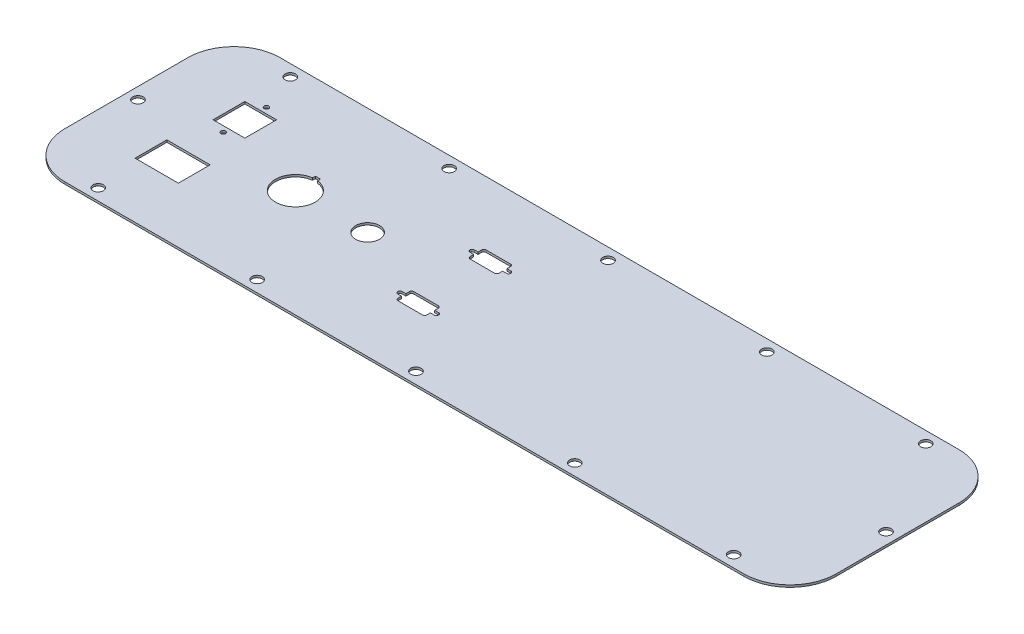
from build123d import *

# Parameters (mm, degrees)
SKETCH1_R           = 3.6
BOSS_EXTRUDE1_DEPTH = 1.5
SKETCH2_R           = 1.6
SKETCH2_R_2         = 8.25
SKETCH2_W           = 22
SKETCH2_H           = 22
SKETCH2_W_2         = 30
CUT_EXTRUDE1_DEPTH  = 278.202994212


with BuildPart() as part:
    # Sketch1 → Boss-Extrude1 (new body)
    with BuildSketch(Plane(origin=(0, 0, 0), x_dir=(1, 0, 0), z_dir=(0, 1, 0))):
        with BuildLine():
            Line((235, -74.5), (-235, -74.5))
            ThreePointArc((-235, -74.5), (-257.627416998, -65.127416998), (-267, -42.5))
            Line((-267, -42.5), (-267, 42.5))
            ThreePointArc((-267, 42.5), (-257.627416998, 65.127416998), (-235, 74.5))
            Line((-235, 74.5), (235, 74.5))
            ThreePointArc((235, 74.5), (257.627416998, 65.127416998), (267, 42.5))
            Line((267, 42.5), (267, -42.5))
            ThreePointArc((267, -42.5), (257.627416998, -65.127416998), (235, -74.5))
        make_face()
        with Locations(Location((-259, 0, 0), (0, 0, 270))):
            Circle(SKETCH1_R, mode=Mode.SUBTRACT)
        with Locations(Location((259, 0, 0), (0, 0, 270))):
            Circle(SKETCH1_R, mode=Mode.SUBTRACT)
        with Locations(Location((-220, 66.5, 0), (0, 0, 270))):
            Circle(SKETCH1_R, mode=Mode.SUBTRACT)
        with Locations(Location((-110, 66.5, 0), (0, 0, 270))):
            Circle(SKETCH1_R, mode=Mode.SUBTRACT)
        with Locations(Location((0, 66.5, 0), (0, 0, 270))):
            Circle(SKETCH1_R, mode=Mode.SUBTRACT)
        with Locations(Location((110, 66.5, 0), (0, 0, 270))):
            Circle(SKETCH1_R, mode=Mode.SUBTRACT)
        with Locations(Location((220, 66.5, 0), (0, 0, 270))):
            Circle(SKETCH1_R, mode=Mode.SUBTRACT)
        with Locations(Location((220, -66.5, 0), (0, 0, 90))):
            Circle(SKETCH1_R, mode=Mode.SUBTRACT)
        with Locations(Location((110, -66.5, 0), (0, 0, 90))):
            Circle(SKETCH1_R, mode=Mode.SUBTRACT)
        with Locations(Location((0, -66.5, 0), (0, 0, 90))):
            Circle(SKETCH1_R, mode=Mode.SUBTRACT)
        with Locations(Location((-110, -66.5, 0), (0, 0, 90))):
            Circle(SKETCH1_R, mode=Mode.SUBTRACT)
        with Locations(Location((-220, -66.5, 0), (0, 0, 90))):
            Circle(SKETCH1_R, mode=Mode.SUBTRACT)
    extrude(amount=BOSS_EXTRUDE1_DEPTH)

    # Sketch2 → Cut-Extrude1 (cut, through all)
    with BuildSketch(Plane(origin=(0, 0, 0), x_dir=(1, 0, 0), z_dir=(0, 1, 0))):
        with Locations(Location((-210, 10, 0), (0, 0, 270))):
            Circle(SKETCH2_R)
        with Locations(Location((-210, 40, 0), (0, 0, 270))):
            Circle(SKETCH2_R)
        with Locations(Location((-100, 0, 0), (0, 0, 270))):
            Circle(SKETCH2_R_2)
        with Locations((-210, 25)):
            Rectangle(SKETCH2_W, SKETCH2_H)
        with BuildLine():
            Line((-151.75, 15.638181697), (-148.25, 15.638181697))
            Line((-148.25, 15.638181697), (-148.25, 13.638181697))
            ThreePointArc((-148.25, 13.638181697), (-150, -13.75), (-151.75, 13.638181697))
            Line((-151.75, 13.638181697), (-151.75, 15.638181697))
        make_face()
        with Locations((-210, -25)):
            Rectangle(SKETCH2_W_2, SKETCH2_H)
        with BuildLine():
            Line((-31.5, 30.5), (-48.5, 30.5))
            ThreePointArc((-48.5, 30.5), (-49.560660172, 30.060660172), (-50, 29))
            Line((-50, 29), (-50, 26.5))
            Line((-50, 26.5), (-52.6, 26.5))
            ThreePointArc((-52.6, 26.5), (-54.1, 25), (-52.6, 23.5))
            Line((-52.6, 23.5), (-50, 23.5))
            Line((-50, 23.5), (-50, 21))
            ThreePointArc((-50, 21), (-49.560660172, 19.939339828), (-48.5, 19.5))
            Line((-48.5, 19.5), (-31.5, 19.5))
            ThreePointArc((-31.5, 19.5), (-30.439339828, 19.939339828), (-30, 21))
            Line((-30, 21), (-30, 23.5))
            Line((-30, 23.5), (-27.4, 23.5))
            ThreePointArc((-27.4, 23.5), (-25.9, 25), (-27.4, 26.5))
            Line((-27.4, 26.5), (-30, 26.5))
            Line((-30, 26.5), (-30, 29))
            ThreePointArc((-30, 29), (-30.439339828, 30.060660172), (-31.5, 30.5))
        make_face()
        with BuildLine():
            Line((-31.5, -19.5), (-48.5, -19.5))
            ThreePointArc((-48.5, -19.5), (-49.560660172, -19.939339828), (-50, -21))
            Line((-50, -21), (-50, -23.5))
            Line((-50, -23.5), (-52.6, -23.5))
            ThreePointArc((-52.6, -23.5), (-54.1, -25), (-52.6, -26.5))
            Line((-52.6, -26.5), (-50, -26.5))
            Line((-50, -26.5), (-50, -29))
            ThreePointArc((-50, -29), (-49.560660172, -30.060660172), (-48.5, -30.5))
            Line((-48.5, -30.5), (-31.5, -30.5))
            ThreePointArc((-31.5, -30.5), (-30.439339828, -30.060660172), (-30, -29))
            Line((-30, -29), (-30, -26.5))
            Line((-30, -26.5), (-27.4, -26.5))
            ThreePointArc((-27.4, -26.5), (-25.9, -25), (-27.4, -23.5))
            Line((-27.4, -23.5), (-30, -23.5))
            Line((-30, -23.5), (-30, -21))
            ThreePointArc((-30, -21), (-30.439339828, -19.939339828), (-31.5, -19.5))
        make_face()
    extrude(amount=CUT_EXTRUDE1_DEPTH, mode=Mode.SUBTRACT)


solid = part.part
